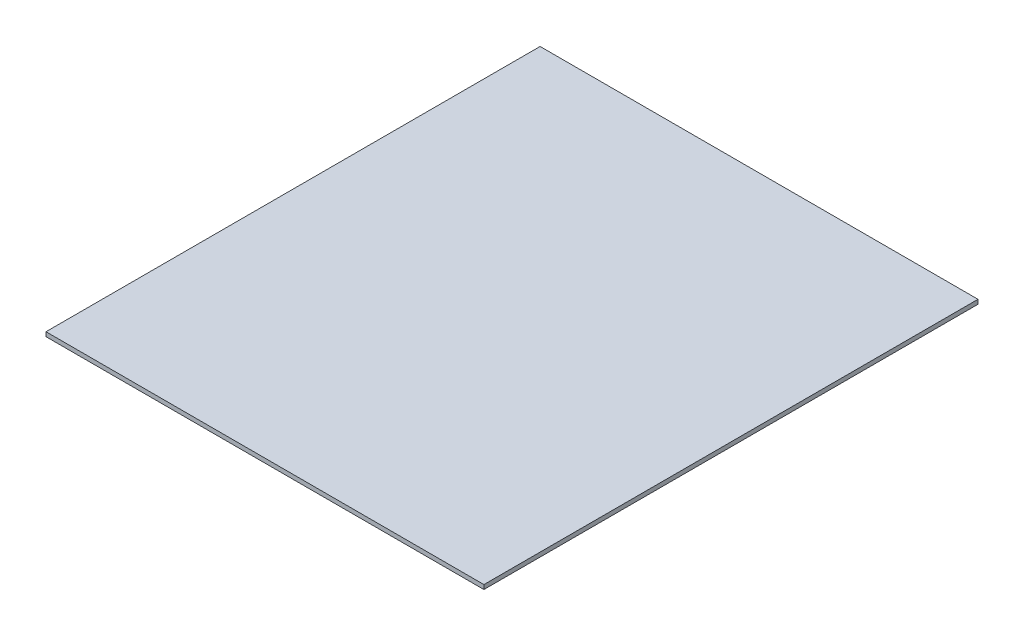
from build123d import *

# Parameters (mm, degrees)
SKETCH1_W           = 304
SKETCH1_H           = 343
BOSS_EXTRUDE1_DEPTH = 3


with BuildPart() as part:
    # Sketch1 → Boss-Extrude1 (new body)
    with BuildSketch(Plane(origin=(0, 0, 0), x_dir=(1, 0, 0), z_dir=(0, 1, 0))):
        with Locations((-1477.541345009, 215.409090909)):
            Rectangle(SKETCH1_W, SKETCH1_H)
    extrude(amount=BOSS_EXTRUDE1_DEPTH)


solid = part.part
